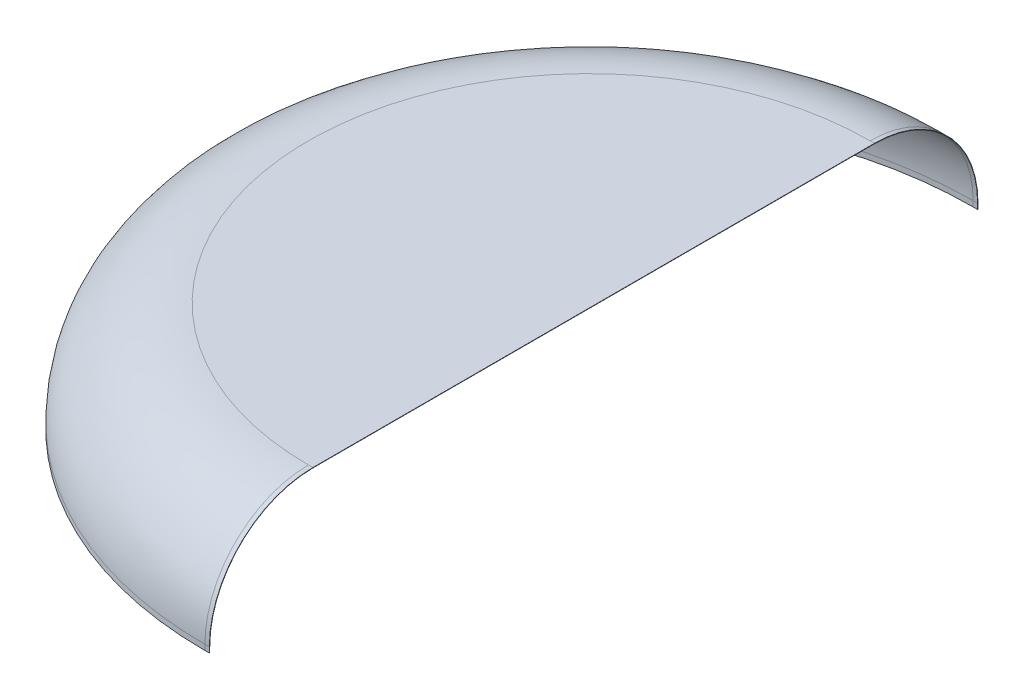
from build123d import *

# Parameters (mm, degrees)
SURFACE_REVOLVE1_2_ANGLE = 180
SURFACE_EXTRUDE1_3_DEPTH = 12.4
THICKEN1_T2              = 1


with BuildPart() as body_1:
    # Surface-Revolve1: a surface, the sketch's curves turned about an axis by 180 degrees
    with BuildLine(Plane(origin=(0, 0, 0), x_dir=(0, 0, -1), z_dir=(1, 0, 0)), mode=Mode.PRIVATE) as surface_revolve1_2_path:
        Line((1067.6, 287.6), (287.6, 287.6))
        ThreePointArc((287.6, 287.6), (84.236089731, 203.363910269), (0, 0))
        Line((0, 0), (0, -15))
    surface_revolve1_2 = Shell.revolve(surface_revolve1_2_path.wire(), SURFACE_REVOLVE1_2_ANGLE, Axis((0, 287.6, -1067.6), (0, -1, 0)))
    # Surface-Extrude1: a surface, the sketch's curves swept straight by 12.4 mm
    with BuildLine(Plane(origin=(0, 0, 0), x_dir=(0, 0, -1), z_dir=(1, 0, 0)), mode=Mode.PRIVATE) as surface_extrude1_3_path:
        Line((0, -15), (0, 0))
        ThreePointArc((0, 0), (84.236089731, 203.363910269), (287.6, 287.6))
        Line((287.6, 287.6), (1847.6, 287.6))
        ThreePointArc((1847.6, 287.6), (2050.963910269, 203.363910269), (2135.2, 0))
        Line((2135.2, 0), (2135.2, -15))
    surface_extrude1_3 = Shell.extrude(surface_extrude1_3_path.wire(), (1 * SURFACE_EXTRUDE1_3_DEPTH, 0 * SURFACE_EXTRUDE1_3_DEPTH, 0 * SURFACE_EXTRUDE1_3_DEPTH))
    # Surface-Knit1: the surfaces knitted into one
    surface_knit1_1 = Shell(Face.sew_faces(surface_revolve1_2.faces() + surface_extrude1_3.faces())[0])
    add(Solid.thicken(surface_knit1_1, -THICKEN1_T2))


solid = body_1.part
